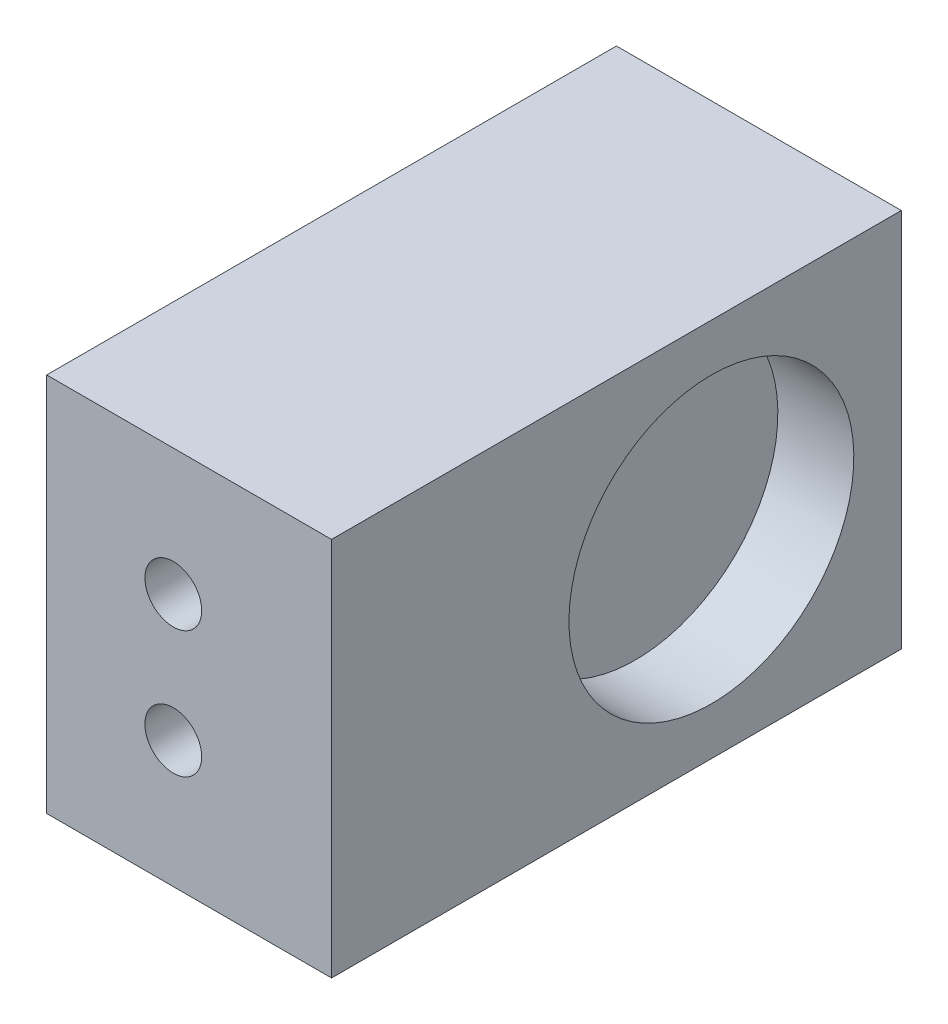
from build123d import *

# Parameters (mm, degrees)
SKETCH1_W                      = 19.05
SKETCH1_H                      = 25.4
BOSS_EXTRUDE1_DEPTH            = 38.1
TAP_DRILL_FOR_10_24_TAP1_D     = 3.7973
TAP_DRILL_FOR_10_24_TAP1_DEPTH = 19.05
TAP_DRILL_FOR_10_24_TAP1_TIP   = 1.140824014
SKETCH7_R                      = 9.525
CUT_EXTRUDE1_DEPTH             = 5.08


with BuildPart() as part:
    # Sketch1 → Boss-Extrude1 (new body)
    with BuildSketch(Plane.XY):
        with Locations((-9.525, 12.7)):
            Rectangle(SKETCH1_W, SKETCH1_H)
    extrude(amount=BOSS_EXTRUDE1_DEPTH)

    # Tap Drill for #10-24 Tap1
    with Locations(Plane.XY.offset(38.1)):
        with Locations((-10.583333333, 16.933333333), (-10.583333333, 8.466666667)):
            Hole(TAP_DRILL_FOR_10_24_TAP1_D / 2, depth=TAP_DRILL_FOR_10_24_TAP1_DEPTH)
            with Locations((0, 0, -(TAP_DRILL_FOR_10_24_TAP1_DEPTH + TAP_DRILL_FOR_10_24_TAP1_TIP / 2))):  # 118° drill point
                Cone(0, TAP_DRILL_FOR_10_24_TAP1_D / 2, TAP_DRILL_FOR_10_24_TAP1_TIP, mode=Mode.SUBTRACT)

    # Sketch7 → Cut-Extrude1 (cut)
    with BuildSketch(Plane(origin=(0, 0, 0), x_dir=(0, 0, -1), z_dir=(1, 0, 0))):
        with Locations(Location((-12.7, 12.7, 0), (0, 0, 90))):
            Circle(SKETCH7_R)
    extrude(amount=-CUT_EXTRUDE1_DEPTH, mode=Mode.SUBTRACT)


solid = part.part
